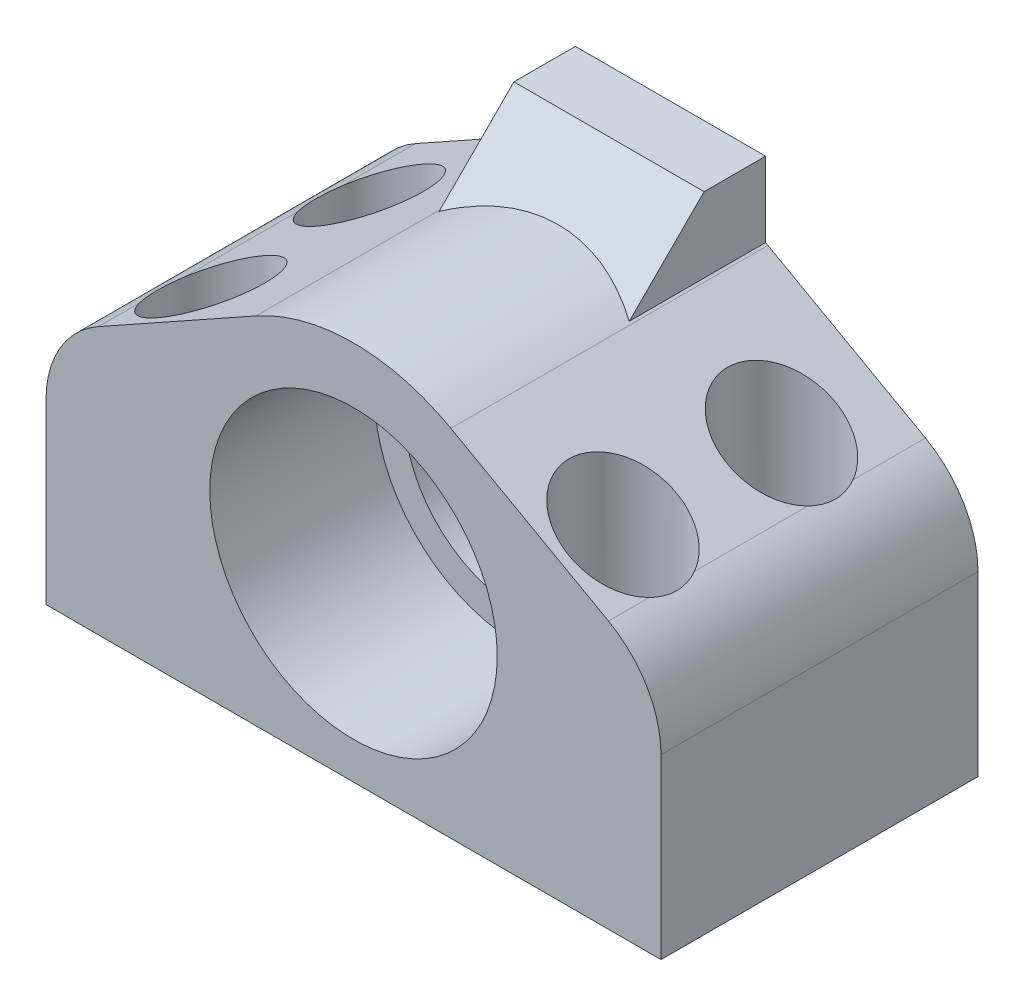
from build123d import *

# Parameters (mm, degrees)
SKETCH1_R           = 9
BOSS_EXTRUDE1_DEPTH = 25
SKETCH2_R           = 11.335
CUT_EXTRUDE1_DEPTH  = 13
CUT_EXTRUDE2_START  = -7
SKETCH3_R           = 11.335
CUT_EXTRUDE2_DEPTH  = 7
BOSS_EXTRUDE2_DEPTH = 4.85
BOSS_EXTRUDE3_DEPTH = 15
SKETCH6_R           = 2.25
CUT_EXTRUDE3_DEPTH  = 49.673016138
SKETCH7_R           = 4.25
CUT_EXTRUDE4_DEPTH  = 43.297310789


with BuildPart() as part:
    # Sketch1 → Boss-Extrude1 (new body)
    with BuildSketch(Plane.XY):
        with BuildLine():
            Line((24.25, 4), (24.25, -10))
            Line((24.25, -10), (-24.25, -10))
            Line((-24.25, -10), (-24.25, 4))
            ThreePointArc((-24.25, 4), (-23.13858198, 8.090248735), (-20.11, 11.055560845))
            Line((-20.11, 11.055560845), (-7.682261614, 17.999376585))
            ThreePointArc((-7.682261614, 17.999376585), (0, 20), (7.682261614, 17.999376585))
            Line((7.682261614, 17.999376585), (20.11, 11.055560845))
            ThreePointArc((20.11, 11.055560845), (23.13858198, 8.090248735), (24.25, 4))
        make_face()
        with Locations((0, 4.25)):
            Circle(SKETCH1_R, mode=Mode.SUBTRACT)
    extrude(amount=BOSS_EXTRUDE1_DEPTH)

    # Sketch2 → Cut-Extrude1 (cut)
    with BuildSketch(Plane.XY.offset(25)):
        with Locations((0, 4.25)):
            Circle(SKETCH2_R)
    extrude(amount=-CUT_EXTRUDE1_DEPTH, mode=Mode.SUBTRACT)

    # Sketch3 → Cut-Extrude2 (cut)
    with BuildSketch(Plane(origin=(0, 0, 0), x_dir=(-1, 0, 0), z_dir=(0, 0, -1)).offset(CUT_EXTRUDE2_START)):
        with Locations(Location((0, 4.25, 0), (0, 0, 180))):
            Circle(SKETCH3_R)
    extrude(amount=CUT_EXTRUDE2_DEPTH, mode=Mode.SUBTRACT)



with BuildPart() as body_2:
    # Sketch4 → Boss-Extrude2 (new body)
    with BuildSketch(Plane(origin=(0, 0, 0), x_dir=(-1, 0, 0), z_dir=(0, 0, -1))):
        with BuildLine():
            Line((-7.5, 18.101212577), (-7.5, 24))
            Line((-7.5, 24), (7.5, 24))
            Line((7.5, 24), (7.5, 18.101212577))
            ThreePointArc((7.5, 18.101212577), (0, 20.001383744), (-7.5, 18.101212577))
        make_face()
    extrude(amount=-BOSS_EXTRUDE2_DEPTH)


with BuildPart() as part_1:
    add(part.part)

    add(body_2.part)  # Boss-Extrude3 merges body 2
    # Sketch5 → Boss-Extrude3 (add)
    with BuildSketch(Plane(origin=(7.5, 0, 0), x_dir=(0, 0, -1), z_dir=(1, 0, 0))):
        Polygon((-4.85, 24), (-4.85, 18.101212577), (-10.748787423, 18.101212577), align=None)
    extrude(amount=-BOSS_EXTRUDE3_DEPTH)

    # Sketch6 → Cut-Extrude3 (cut, through all)
    with BuildSketch(Plane.XZ.offset(10)):
        with Locations((-16.25, 20)):
            Circle(SKETCH6_R)
        with Locations((16.25, 20)):
            Circle(SKETCH6_R)
        with Locations((16.25, 7.5)):
            Circle(SKETCH6_R)
        with Locations((-16.25, 7.5)):
            Circle(SKETCH6_R)
    extrude(amount=-CUT_EXTRUDE3_DEPTH, mode=Mode.SUBTRACT)

    # Sketch7 → Cut-Extrude4 (cut, through all)
    with BuildSketch(Plane(origin=(0, 0, 0), x_dir=(-1, 0, 0), z_dir=(0, -1, 0))):
        with Locations(Location((16.25, -20, 0), (0, 0, 180))):
            Circle(SKETCH7_R)
        with Locations(Location((16.25, -7.5, 0), (0, 0, 180))):
            Circle(SKETCH7_R)
        with Locations(Location((-16.25, -7.5, 0), (0, 0, 180))):
            Circle(SKETCH7_R)
        with Locations(Location((-16.25, -20, 0), (0, 0, 180))):
            Circle(SKETCH7_R)
    extrude(amount=-CUT_EXTRUDE4_DEPTH, mode=Mode.SUBTRACT)


solid = part_1.part
